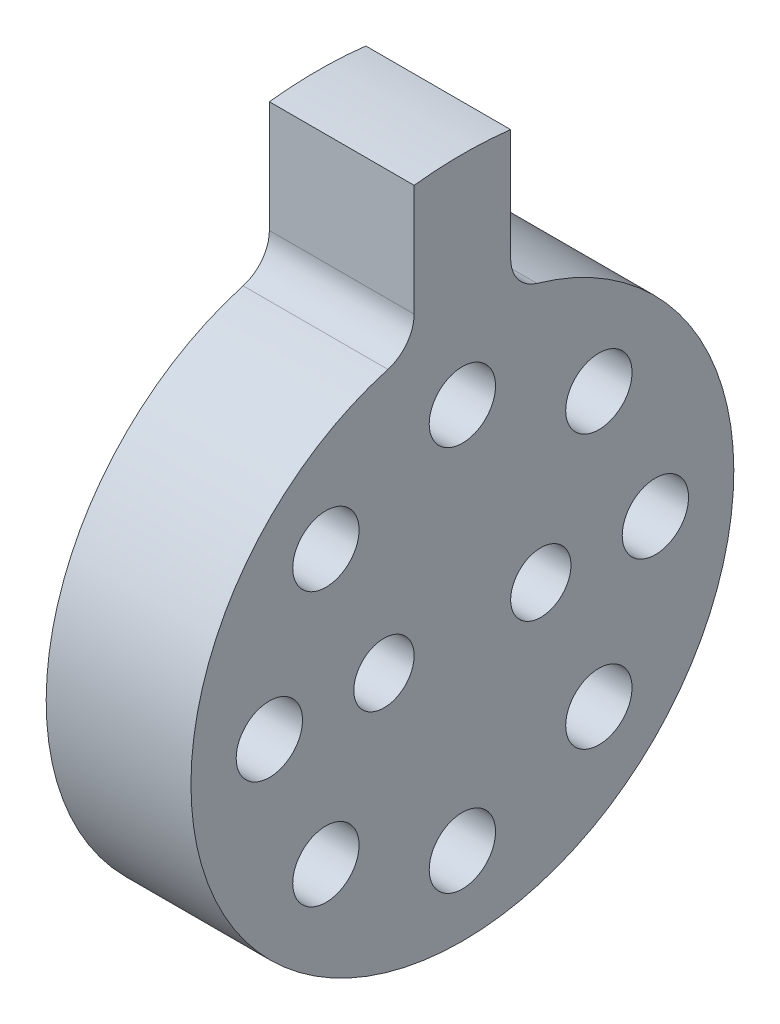
from build123d import *

# Parameters (mm, degrees)
SKETCH_1_R                = 34
EXTRUDE_1_DEPTH           = 12
HOLE_WIZARD_1_D           = 5.5
HOLE_WIZARD_1_CBORE_D     = 10
HOLE_WIZARD_1_CBORE_DEPTH = 5.7
PATTERN_CIRCULAR_1_COUNT  = 8
SKETCH_4_OUTSIDE_W        = 89.382
SKETCH_4_OUTSIDE_H        = 89.382
CUT_EXTRUDE_2_DEPTH       = 50.558046773
HOLE_WIZARD_M6_1_D        = 5
FILLET_1_R                = 3


with BuildPart() as part:
    # 草图1 → 凸台-拉伸1 (new body)
    with BuildSketch(Plane(origin=(0, 0, 0), x_dir=(0, 0, -1), z_dir=(1, 0, 0))):
        Circle(SKETCH_1_R)
    extrude(amount=EXTRUDE_1_DEPTH)

    # 打孔尺寸根据内六角圆柱头螺钉的类型1 (through all)
    with Locations(Plane.ZY):
        with Locations((0, 16)):
            hole_wizard_1 = CounterBoreHole(HOLE_WIZARD_1_D / 2, HOLE_WIZARD_1_CBORE_D / 2, HOLE_WIZARD_1_CBORE_DEPTH)

    # 阵列(圆周)1: 打孔尺寸根据内六角圆柱头螺钉的类型1 ×8 about axis
    pattern_circular_1_axis = Axis((0, 0, 0), (1, 0, 0))
    for i in range(1, PATTERN_CIRCULAR_1_COUNT):
        add(hole_wizard_1.rotate(pattern_circular_1_axis, i * 360 / PATTERN_CIRCULAR_1_COUNT), mode=Mode.SUBTRACT)

    # 草图4 outside → 切除-拉伸2 (cut, through all)
    with BuildSketch(Plane.ZY):
        Rectangle(SKETCH_4_OUTSIDE_W, SKETCH_4_OUTSIDE_H)
        with BuildLine():
            Line((-4, 33.763886032), (-4, 22.141589825))
            ThreePointArc((-4, 22.141589825), (0, -22.5), (4, 22.141589825))
            Line((4, 22.141589825), (4, 33.763886032))
            ThreePointArc((4, 33.763886032), (0, 34), (-4, 33.763886032))
        make_face(mode=Mode.SUBTRACT)
    extrude(amount=-CUT_EXTRUDE_2_DEPTH, mode=Mode.SUBTRACT)

    # M6 螺纹孔1 (through all)
    with Locations(Plane.ZY):
        with Locations((6.5, 0), (-6.5, 0)):
            Hole(HOLE_WIZARD_M6_1_D / 2)

    # 圆角1
    fillet_1_edges = [part.edges().sort_by_distance(p)[0] for p in [
        (6, 22.141589825, 4),
        (6, 22.141589825, -4),
    ]]
    fillet(fillet_1_edges, radius=FILLET_1_R)


solid = part.part
